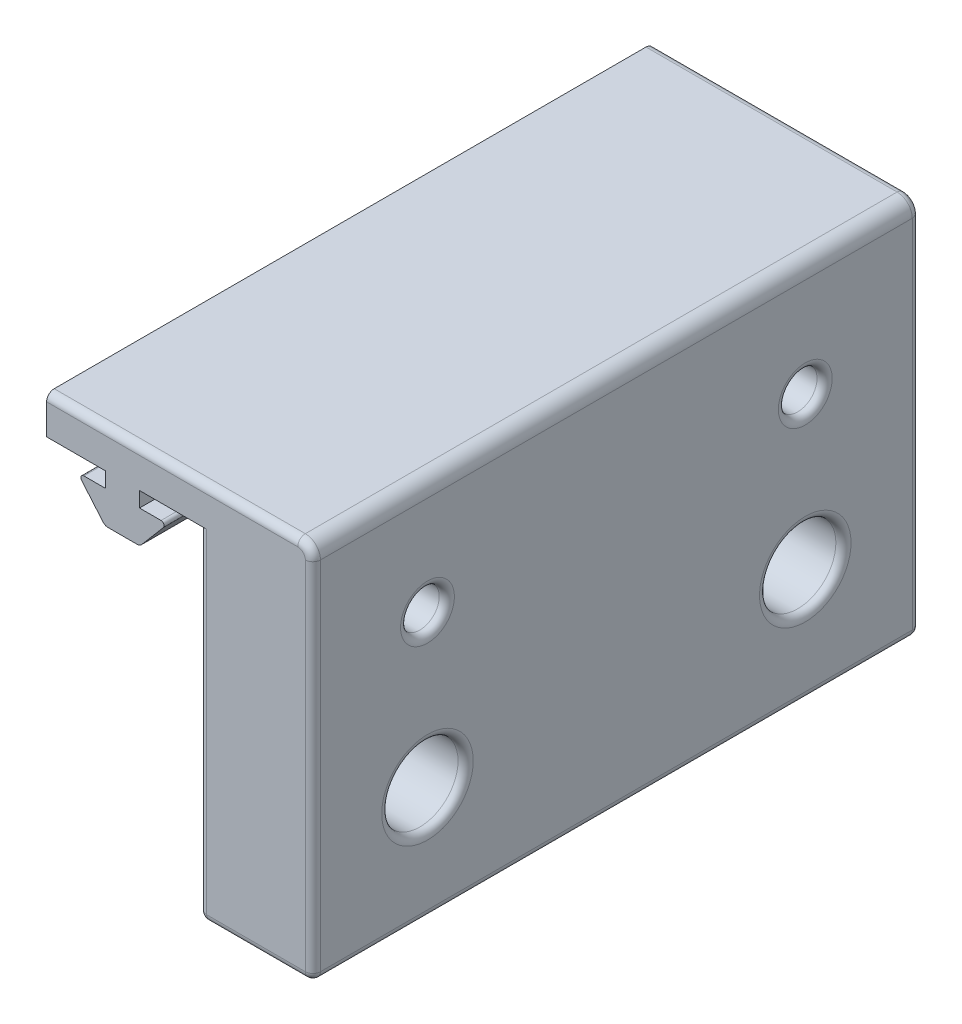
from build123d import *

# Parameters (mm, degrees)
SKETCH1_W           = 25.654
SKETCH1_H           = 6.35
BOSS_EXTRUDE1_DEPTH = 101.6
FILLET1_R           = 0.508
FILLET2_R           = 1.016
SKETCH3_W           = 19.05
SKETCH3_H           = 63.5
BOSS_EXTRUDE3_DEPTH = 101.6
SKETCH4_R           = 6.3881
CUT_EXTRUDE1_DEPTH  = 25.4
FILLET3_R           = 2.54
FILLET4_R           = 1.27
FILLET5_R           = 1.27
CUT_EXTRUDE3_REACH  = 119.452
SKETCH5_R           = 3.2385
FILLET7_R           = 1.27
SKETCH6_W           = 0.127
SKETCH6_H           = 6.35
CUT_EXTRUDE4_DEPTH  = 114.192714866


with BuildPart() as part:
    # Sketch1 → Boss-Extrude1 (new body)
    with BuildSketch(Plane.XY):
        with Locations((0, 21.933756602)):
            Rectangle(SKETCH1_W, SKETCH1_H)
        Polygon((2.851307039, 16.218756602), (2.857235141, 18.758756602), (-2.856686021, 18.758756602), (-2.851856159, 16.218756602), (-7.55677456, 16.218756602), (-2.921, 10.757756602), (2.921, 10.757756602), (7.55622544, 16.218756602), align=None)
    extrude(amount=BOSS_EXTRUDE1_DEPTH)

    # Fillet1
    fillet1_edges = [part.edges().sort_by_distance(p)[0] for p in [
        (7.55622544, 16.218756602, 50.8),
        (-7.55677456, 16.218756602, 50.8),
    ]]
    fillet(fillet1_edges, radius=FILLET1_R)

    # Fillet2
    fillet2_edges = [part.edges().sort_by_distance(p)[0] for p in [
        (2.921, 10.757756602, 50.8),
        (-2.921, 10.757756602, 50.8),
    ]]
    fillet(fillet2_edges, radius=FILLET2_R)

    # Sketch3 → Boss-Extrude3 (add)
    with BuildSketch(Plane(origin=(0, 0, 0), x_dir=(-1, 0, 0), z_dir=(0, 0, -1))):
        with Locations((-22.352, -6.641243398)):
            Rectangle(SKETCH3_W, SKETCH3_H)
    extrude(amount=-BOSS_EXTRUDE3_DEPTH)

    # Sketch4 → Cut-Extrude1 (cut)
    with BuildSketch(Plane(origin=(31.877, 0, 0), x_dir=(0, 0, -1), z_dir=(1, 0, 0))):
        with Locations(Location((-19.177, -19.341243398, 0), (0, 0, 90))):
            Circle(SKETCH4_R)
        with Locations(Location((-82.423, -19.341243398, 0), (0, 0, 90))):
            Circle(SKETCH4_R)
    extrude(amount=-CUT_EXTRUDE1_DEPTH, mode=Mode.SUBTRACT)

    # Fillet3
    fillet3_edges = [part.edges().sort_by_distance(p)[0] for p in [
        (31.877, 25.108756602, 50.8),
    ]]
    fillet(fillet3_edges, radius=FILLET3_R)

    # Fillet4
    fillet4_edges = [part.edges().sort_by_distance(p)[0] for p in [
        (31.877, -25.729343398, 82.423),
        (31.877, -25.729343398, 19.177),
    ]]
    fillet(fillet4_edges, radius=FILLET4_R)

    # Fillet5
    fillet5_edges = [part.edges().sort_by_distance(p)[0] for p in [
        (8.255, 25.108756602, 0),
        (8.255, 25.108756602, 101.6),
        (12.827, -9.816243398, 0),
        (22.352, -38.391243398, 0),
        (31.877, -38.391243398, 50.8),
        (22.352, -38.391243398, 101.6),
        (12.827, -38.391243398, 50.8),
        (12.827, -9.816243398, 101.6),
        (31.877, -7.911243398, 0),
        (31.133051224, 24.364807826, 0),
        (31.877, -7.911243398, 101.6),
        (31.133051224, 24.364807826, 101.6),
    ]]
    fillet(fillet5_edges, radius=FILLET5_R)

    # Sketch5 → Cut-Extrude3 (cut, up to next)
    with BuildSketch(Plane(origin=(31.877, 0, 0), x_dir=(0, 0, -1), z_dir=(1, 0, 0)), mode=Mode.PRIVATE) as cut_extrude3_sk1:
        with Locations(Location((-82.423, 6.058756602, 0), (0, 0, 90))):
            Circle(SKETCH5_R)
    cut_extrude3_tool1 = extrude(cut_extrude3_sk1.sketch, amount=-CUT_EXTRUDE3_REACH, mode=Mode.PRIVATE) & part.part
    # Sketch5 → Cut-Extrude3 (cut, up to next)
    with BuildSketch(Plane(origin=(31.877, 0, 0), x_dir=(0, 0, -1), z_dir=(1, 0, 0)), mode=Mode.PRIVATE) as cut_extrude3_sk2:
        with Locations(Location((-19.177, 6.058756602, 0), (0, 0, 90))):
            Circle(SKETCH5_R)
    cut_extrude3_tool2 = extrude(cut_extrude3_sk2.sketch, amount=-CUT_EXTRUDE3_REACH, mode=Mode.PRIVATE) & part.part
    add(cut_extrude3_tool1.solids().sort_by_distance((31.877, 6.058757, 82.423))[0], mode=Mode.SUBTRACT)
    add(cut_extrude3_tool2.solids().sort_by_distance((31.877, 6.058757, 19.177))[0], mode=Mode.SUBTRACT)

    # Fillet7
    fillet7_edges = [part.edges().sort_by_distance(p)[0] for p in [
        (31.877, 2.820256602, 82.423),
        (31.877, 2.820256602, 19.177),
    ]]
    fillet(fillet7_edges, radius=FILLET7_R)

    # Sketch6 → Cut-Extrude4 (cut, through all)
    with BuildSketch(Plane.XY.offset(101.6)):
        with Locations((-12.7635, 21.933756602)):
            Rectangle(SKETCH6_W, SKETCH6_H)
    extrude(amount=-CUT_EXTRUDE4_DEPTH, mode=Mode.SUBTRACT)


solid = part.part
